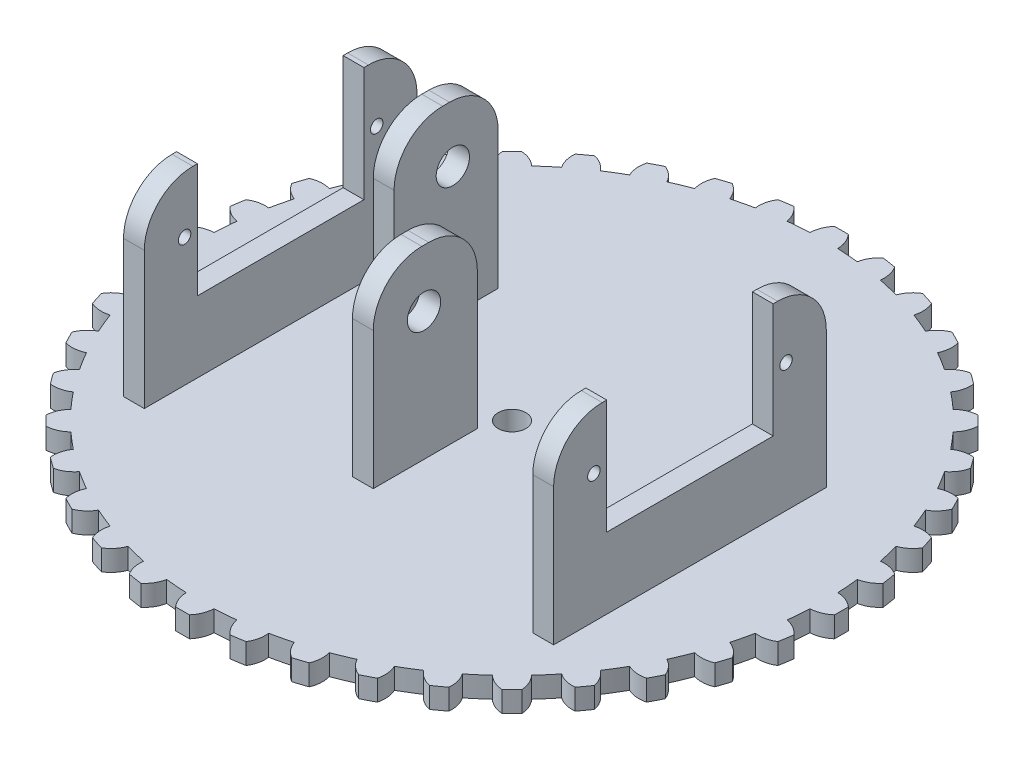
from build123d import *

# Parameters (mm, degrees)
SKETCH1_R           = 45
SKETCH1_R_2         = 2
BOSS_EXTRUDE1_DEPTH = 3
BOSS_EXTRUDE2_DEPTH = 3
CIRPATTERN2_COUNT   = 40
SKETCH4_W           = 3
SKETCH4_H           = 9.3
SKETCH4_H_2         = 30
SKETCH4_H_3         = 39.3
SKETCH4_H_4         = 15
BOSS_EXTRUDE3_DEPTH = 26.75
FILLET1_R           = 7
SKETCH5_R           = 0.9
SKETCH5_W           = 24
SKETCH5_H           = 16.5
CUT_EXTRUDE1_DEPTH  = 3
CUT_EXTRUDE2_REACH  = 87.827
SKETCH7_R           = 2.4
CUT_EXTRUDE3_REACH  = 76.447
SKETCH8_R           = 2.4
FILLET3_R           = 7


with BuildPart() as part:
    # Sketch1 → Boss-Extrude1 (new body)
    with BuildSketch(Plane(origin=(0, 0, 0), x_dir=(1, 0, 0), z_dir=(0, 1, 0))):
        with Locations(Location((0, 0, 0), (0, 0, 270))):
            Circle(SKETCH1_R)
        with Locations(Location((0, 0, 0), (0, 0, 270))):
            Circle(SKETCH1_R_2, mode=Mode.SUBTRACT)
    extrude(amount=BOSS_EXTRUDE1_DEPTH)

    # Sketch2 → Boss-Extrude2 (add)
    with BuildSketch(Plane(origin=(0, 0, 0), x_dir=(1, 0, 0), z_dir=(0, 1, 0))):
        with BuildLine():
            ThreePointArc((2, 44.955533586), (1.722355394, 46.310253941), (1, 47.489472518))
            ThreePointArc((1, 47.489472518), (0, 47.5), (-1, 47.489472518))
            ThreePointArc((-1, 47.489472518), (-1.722355394, 46.310253941), (-2, 44.955533586))
            ThreePointArc((-2, 44.955533586), (-1.000247127, 44.988882023), (0, 45))
            ThreePointArc((0, 45), (1.000247127, 44.988882023), (2, 44.955533586))
        make_face()
    boss_extrude2 = extrude(amount=BOSS_EXTRUDE2_DEPTH)

    # CirPattern2: Boss-Extrude2 ×40 about axis
    cirpattern2_axis = Axis((0, 0, 0), (0, 1, 0))
    for i in range(1, CIRPATTERN2_COUNT):
        add(boss_extrude2.rotate(cirpattern2_axis, i * 360 / CIRPATTERN2_COUNT))

    # Sketch4 → Boss-Extrude3 (add)
    with BuildSketch(Plane(origin=(0, 3, 0), x_dir=(1, 0, 0), z_dir=(0, 1, 0))):
        with Locations((-29.5, 9.65)):
            Rectangle(SKETCH4_W, SKETCH4_H)
        with Locations((-29.5, -10)):
            Rectangle(SKETCH4_W, SKETCH4_H_2)
        with Locations((29.5, -5.35)):
            Rectangle(SKETCH4_W, SKETCH4_H_3)
        with Locations((-19, 8)):
            Rectangle(SKETCH4_W, SKETCH4_H_4)
        with Locations((-3, -11)):
            Rectangle(SKETCH4_W, SKETCH4_H_4)
    extrude(amount=BOSS_EXTRUDE3_DEPTH)

    # Fillet1
    fillet1_edges = [part.edges().sort_by_distance(p)[0] for p in [
        (-29.5, 29.75, -14.3),
        (-29.5, 29.75, 25),
        (29.5, 29.75, 25),
        (29.5, 29.75, -14.3),
    ]]
    fillet(fillet1_edges, radius=FILLET1_R)

    # Sketch5 → Cut-Extrude1 (cut)
    with BuildSketch(Plane.ZY.offset(31)):
        with Locations((-8.5, 21.5)):
            Circle(SKETCH5_R)
        with Locations(Location((19.2, 21.5, 0), (0, 0, 180))):
            Circle(SKETCH5_R)
        with Locations((5.35, 21.5)):
            Rectangle(SKETCH5_W, SKETCH5_H)
    cut_extrude1 = extrude(amount=-CUT_EXTRUDE1_DEPTH, mode=Mode.SUBTRACT)

    # Mirror2: Cut-Extrude1 across plane
    add(cut_extrude1.mirror(Plane(origin=(0, 0, 0), x_dir=(0, 0, 1), z_dir=(1, 0, 0))), mode=Mode.SUBTRACT)

    # Sketch7 → Cut-Extrude2 (cut, up to next)
    with BuildSketch(Plane(origin=(-17.5, 0, 0), x_dir=(0, 0, -1), z_dir=(1, 0, 0)), mode=Mode.PRIVATE) as cut_extrude2_sk1:
        with Locations((8.97323793, 21.5)):
            Circle(SKETCH7_R)
    cut_extrude2_tool1 = extrude(cut_extrude2_sk1.sketch, amount=-CUT_EXTRUDE2_REACH, mode=Mode.PRIVATE) & part.part
    add(cut_extrude2_tool1.solids().sort_by_distance((-17.5, 21.5, -8.973238))[0], mode=Mode.SUBTRACT)

    # Sketch8 → Cut-Extrude3 (cut, up to next)
    with BuildSketch(Plane(origin=(-1.5, 0, 0), x_dir=(0, 0, -1), z_dir=(1, 0, 0)), mode=Mode.PRIVATE) as cut_extrude3_sk1:
        with Locations((-11.187260454, 21.5)):
            Circle(SKETCH8_R)
    cut_extrude3_tool1 = extrude(cut_extrude3_sk1.sketch, amount=-CUT_EXTRUDE3_REACH, mode=Mode.PRIVATE) & part.part
    add(cut_extrude3_tool1.solids().sort_by_distance((-1.5, 21.5, 11.18726))[0], mode=Mode.SUBTRACT)

    # Fillet3
    fillet3_edges = [part.edges().sort_by_distance(p)[0] for p in [
        (-19, 29.75, -15.5),
        (-19, 29.75, -0.5),
        (-3, 29.75, 3.5),
        (-3, 29.75, 18.5),
    ]]
    fillet(fillet3_edges, radius=FILLET3_R)


solid = part.part
